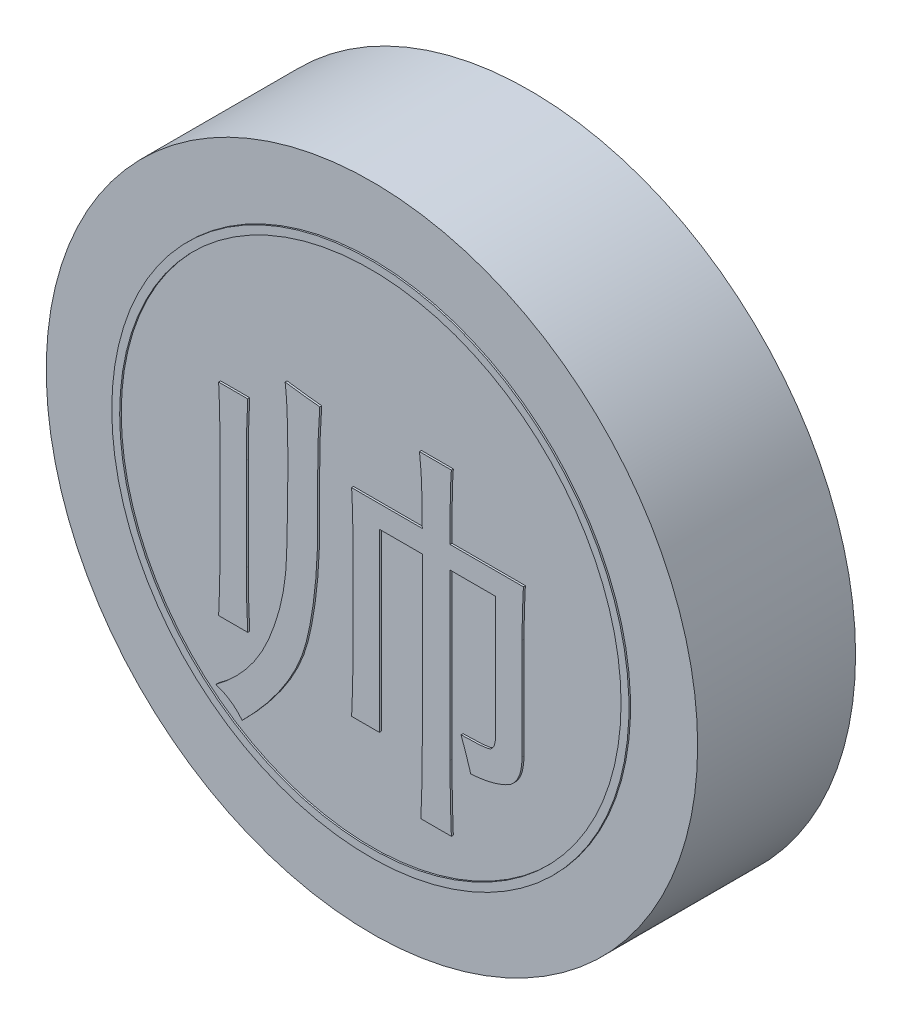
from build123d import *

# Parameters (mm, degrees)
SKETCH_1_R               = 16.5
DIAMETER33_HEIGHT8_DEPTH = 8
CHARACTER_DEPTH          = 0.1
SKETCH_3_R               = 13.1
SKETCH_3_R_2             = 12.7
INK_RING_DEPTH           = 0.08


with BuildPart() as part:
    # 草图1 → Diameter33_Height8 (new body)
    with BuildSketch(Plane.XY):
        Circle(SKETCH_1_R)
    extrude(amount=-DIAMETER33_HEIGHT8_DEPTH)

    # 草图2 → Character_帅 (add)
    with BuildSketch(Plane.XY):
        with BuildLine():
            add(Edge.make_bspline(
                [(2.649122807, 2.657894737), (2.648277509, 2.838961546), (2.646647548, 3.188106947), (2.643949337, 3.693304246), (2.627710858, 4.161013978), (2.618261471, 4.592706352), (2.59561766, 4.986803608), (2.573364544, 5.343905172), (2.545932395, 5.6629896), (2.520624442, 5.862638482), (2.50877193, 5.956140351)],
                knots=[0, 0, 0, 0, 1.315583411, 2.536797873, 3.670260287, 4.715635349, 5.673736592, 6.537953599, 7.315277556, 8, 8, 8, 8], degree=3))
            Line((2.50877193, 5.956140351), (4.122807018, 5.956140351))
            add(Edge.make_bspline(
                [(4.122807018, 5.956140351), (4.117499898, 5.877309705), (4.105781963, 5.703254378), (4.089167905, 5.417436401), (4.081123846, 5.081109437), (4.069497803, 4.693902375), (4.062208699, 4.256354693), (4.058010495, 3.768573009), (4.051072159, 3.230576781), (4.052096052, 2.854561793), (4.052631579, 2.657894737)],
                knots=[0, 0, 0, 0, 0.574688494, 1.268892212, 2.082186167, 3.021459211, 4.086593269, 5.265055303, 6.569542337, 8, 8, 8, 8], degree=3))
            Line((4.052631579, 2.657894737), (7.771929825, 2.657894737))
            add(Edge.make_bspline(
                [(7.771929825, 2.657894737), (7.760796072, 2.449999982), (7.73890673, 2.041271737), (7.719157498, 1.435549924), (7.705407242, 0.848123825), (7.702957274, 0.461670931), (7.701754386, 0.271929825)],
                knots=[0, 0, 0, 0, 1.046485867, 2.057427233, 3.046233291, 4, 4, 4, 4], degree=3))
            Line((7.701754386, 0.271929825), (7.701754386, -4.850877193))
            add(Edge.make_bspline(
                [(7.701754386, -4.850877193), (7.700509851, -4.946341409), (7.69812364, -5.129379766), (7.659319509, -5.390999722), (7.605347303, -5.628411903), (7.522536164, -5.840237206), (7.420768732, -6.029019154), (7.289859981, -6.189160821), (7.140756422, -6.328733562), (6.901013102, -6.472408104), (6.563626246, -6.612761018), (6.121927666, -6.749793211), (5.6299881, -6.842128832), (5.284963987, -6.870952514), (5.105263158, -6.885964912)],
                knots=[0, 0, 0, 0, 0.91195479, 1.748536932, 2.524193789, 3.235017793, 3.917413987, 4.565660724, 5.204897301, 5.860042995, 7.225363373, 8.690313679, 10.276197647, 12, 12, 12, 12], degree=3))
            add(Edge.make_bspline(
                [(5.105263158, -6.885964912), (5.030622329, -6.645449861), (4.877118075, -6.150813287), (4.703323003, -5.662931781), (4.614035088, -5.412280702)],
                knots=[0, 0, 0, 0, 0.972491982, 2, 2, 2, 2], degree=3))
            add(Edge.make_bspline(
                [(4.614035088, -5.412280702), (4.703272413, -5.411616614), (4.873964221, -5.410346357), (5.116579774, -5.405384501), (5.334043291, -5.397378419), (5.526579613, -5.38822529), (5.693812444, -5.372515338), (5.836088174, -5.354724862), (5.952359909, -5.334162259), (6.04894766, -5.312443399), (6.128856661, -5.275644675), (6.193160306, -5.21721386), (6.247720931, -5.142694696), (6.295806352, -5.050517957), (6.327140956, -4.938045189), (6.350107, -4.808315534), (6.366009975, -4.660655055), (6.367588242, -4.555491891), (6.368421053, -4.5)],
                knots=[0, 0, 0, 0, 1.810479571, 3.463057961, 4.922871987, 6.225442376, 7.372781237, 8.329861336, 9.133212, 9.768407665, 10.334419243, 10.894946083, 11.510128595, 12.201898471, 12.991479159, 13.867141808, 14.874545699, 16, 16, 16, 16], degree=3))
            Line((6.368421053, -4.5), (6.368421053, 1.535087719))
            Line((6.368421053, 1.535087719), (4.052631579, 1.535087719))
            Line((4.052631579, 1.535087719), (4.052631579, -6.815789474))
            add(Edge.make_bspline(
                [(4.052631579, -6.815789474), (4.053765197, -7.103428128), (4.056001813, -7.670936452), (4.069634056, -8.508736417), (4.088763125, -9.320656714), (4.11158118, -9.852421744), (4.122807018, -10.114035088)],
                knots=[0, 0, 0, 0, 1.046194404, 2.064131589, 3.047607535, 4, 4, 4, 4], degree=3))
            Line((4.122807018, -10.114035088), (2.578947368, -10.114035088))
            add(Edge.make_bspline(
                [(2.578947368, -10.114035088), (2.590173206, -9.852421744), (2.612991261, -9.320656714), (2.63212033, -8.508736417), (2.645752573, -7.670936452), (2.647989189, -7.103428128), (2.649122807, -6.815789474)],
                knots=[0, 0, 0, 0, 0.952392465, 1.935868411, 2.953805596, 4, 4, 4, 4], degree=3))
            Line((2.649122807, -6.815789474), (2.649122807, 1.535087719))
            Line((2.649122807, 1.535087719), (0.473684211, 1.535087719))
            Line((0.473684211, 1.535087719), (0.473684211, -7.377192982))
            Line((0.473684211, -7.377192982), (-0.929824561, -7.377192982))
            add(Edge.make_bspline(
                [(-0.929824561, -7.377192982), (-0.918712527, -7.137237676), (-0.89705509, -6.669562974), (-0.877305751, -5.985025613), (-0.863382791, -5.336096743), (-0.860869477, -4.914994784), (-0.859649123, -4.710526316)],
                knots=[0, 0, 0, 0, 1.08047164, 2.105847367, 3.080283338, 4, 4, 4, 4], degree=3))
            Line((-0.859649123, -4.710526316), (-0.859649123, 0.271929825))
            add(Edge.make_bspline(
                [(-0.859649123, 0.271929825), (-0.860778179, 0.479865427), (-0.863003576, 0.889711309), (-0.876691761, 1.495334741), (-0.895801581, 2.082918827), (-0.918599793, 2.468200268), (-0.929824561, 2.657894737)],
                knots=[0, 0, 0, 0, 1.045182189, 2.060078265, 3.044873733, 4, 4, 4, 4], degree=3))
            Line((-0.929824561, 2.657894737), (2.649122807, 2.657894737))
        make_face()
        with BuildLine():
            add(Edge.make_bspline(
                [(-2.543859649, 5.394736842), (-2.55453691, 5.241410089), (-2.576968973, 4.919282974), (-2.606332671, 4.4133937), (-2.625722602, 3.862230343), (-2.641455489, 3.266150249), (-2.651530629, 2.625004365), (-2.656494342, 1.938824334), (-2.656719765, 1.207587715), (-2.649857053, 0.442624259), (-2.646120363, -0.33291913), (-2.667300728, -1.096525685), (-2.709346485, -1.836581392), (-2.767619156, -2.554468791), (-2.849443973, -3.249377344), (-2.946107025, -3.921647543), (-3.067303461, -4.570685232), (-3.204881304, -5.204412609), (-3.386965023, -5.831459902), (-3.6329141, -6.458227284), (-3.948908402, -7.087582997), (-4.324035754, -7.726937374), (-4.768016313, -8.370052347), (-5.274742334, -9.020901708), (-5.843502049, -9.679758443), (-6.259926358, -10.105844174), (-6.473684211, -10.324561404)],
                knots=[0, 0, 0, 0, 0.659190093, 1.384905098, 2.173195898, 3.024385089, 3.942285353, 4.923260466, 5.96737447, 7.078396075, 8.204255659, 9.293363896, 10.354008229, 11.383098418, 12.381857005, 13.354528352, 14.295395268, 15.213084928, 16.134880166, 17.092610712, 18.096292209, 19.152239996, 20.269451564, 21.445260402, 22.688607657, 24, 24, 24, 24], degree=3))
            add(Edge.make_bspline(
                [(-6.473684211, -10.324561404), (-6.559732909, -10.223409926), (-6.732267206, -10.020593389), (-7.051816717, -9.772809488), (-7.40742211, -9.558009314), (-7.671581713, -9.461672847), (-7.807017544, -9.412280702)],
                knots=[0, 0, 0, 0, 0.970214787, 1.94535571, 2.94657452, 4, 4, 4, 4], degree=3))
            add(Edge.make_bspline(
                [(-7.807017544, -9.412280702), (-7.657973182, -9.300088741), (-7.363260789, -9.078246324), (-6.955815499, -8.710596291), (-6.57424992, -8.328429932), (-6.223348035, -7.926246582), (-5.904578485, -7.503232626), (-5.618396742, -7.059527971), (-5.360624691, -6.597131501), (-5.135263603, -6.115997615), (-4.940375439, -5.623171603), (-4.765347571, -5.126552857), (-4.614790167, -4.626941063), (-4.485965447, -4.124417421), (-4.385577394, -3.617432725), (-4.307679883, -3.107532014), (-4.251338798, -2.595099135), (-4.218416323, -1.902922648), (-4.195596224, -1.026008016), (-4.174639454, 0.042281327), (-4.161380369, 1.13219518), (-4.159064793, 1.86603464), (-4.157894737, 2.236842105)],
                knots=[0, 0, 0, 0, 0.876110196, 1.73237371, 2.575729557, 3.4124282, 4.237942316, 5.062170833, 5.891260029, 6.723431221, 7.556418375, 8.38034529, 9.196777122, 10.007322445, 10.81680406, 11.623928264, 12.430374722, 13.237591303, 14.878759917, 16.552082939, 18.25777509, 20, 20, 20, 20], degree=3))
            add(Edge.make_bspline(
                [(-4.157894737, 2.236842105), (-4.158742697, 2.42310712), (-4.160379489, 2.782648704), (-4.163043616, 3.302572137), (-4.179306434, 3.783279411), (-4.188638552, 4.224503155), (-4.21144322, 4.62552561), (-4.233545861, 4.986968321), (-4.261113513, 5.309505904), (-4.286397635, 5.510893979), (-4.298245614, 5.605263158)],
                knots=[0, 0, 0, 0, 1.325220203, 2.558031484, 3.6987413, 4.747031617, 5.69752876, 6.556083798, 7.323389997, 8, 8, 8, 8], degree=3))
            add(Edge.make_bspline(
                [(-4.298245614, 5.605263158), (-4.138880204, 5.583255195), (-3.828993721, 5.54046065), (-3.377518369, 5.48397261), (-2.952393963, 5.432706182), (-2.677341911, 5.407142736), (-2.543859649, 5.394736842)],
                knots=[0, 0, 0, 0, 1.092444961, 2.124262261, 3.089707881, 4, 4, 4, 4], degree=3))
        make_face()
        with BuildLine():
            add(Edge.make_bspline(
                [(-6.192982456, 3.921052632), (-6.213127144, 3.470616313), (-6.25390666, 2.558784097), (-6.260049539, 1.646058489), (-6.263157895, 1.184210526)],
                knots=[0, 0, 0, 0, 0.987980705, 2, 2, 2, 2], degree=3))
            Line((-6.263157895, 1.184210526), (-6.263157895, -3.51754386))
            add(Edge.make_bspline(
                [(-6.263157895, -3.51754386), (-6.262026133, -3.760132755), (-6.259790748, -4.239279455), (-6.246045202, -4.949726115), (-6.226937452, -5.6429749), (-6.204202458, -6.099339702), (-6.192982456, -6.324561404)],
                knots=[0, 0, 0, 0, 1.036632017, 2.04749195, 3.036413013, 4, 4, 4, 4], degree=3))
            Line((-6.192982456, -6.324561404), (-7.666666667, -6.324561404))
            add(Edge.make_bspline(
                [(-7.666666667, -6.324561404), (-7.655523902, -6.083740603), (-7.633604379, -5.610009217), (-7.61410139, -4.912465947), (-7.600135574, -4.241012646), (-7.597689835, -3.802584211), (-7.596491228, -3.587719298)],
                knots=[0, 0, 0, 0, 1.05657797, 2.078450635, 3.058287504, 4, 4, 4, 4], degree=3))
            Line((-7.596491228, -3.587719298), (-7.596491228, 1.254385965))
            add(Edge.make_bspline(
                [(-7.596491228, 1.254385965), (-7.597623519, 1.485712467), (-7.599858589, 1.94233606), (-7.613556549, 2.618130935), (-7.632693155, 3.27586782), (-7.655445944, 3.707961922), (-7.666666667, 3.921052632)],
                knots=[0, 0, 0, 0, 1.040483654, 2.053847617, 3.040239174, 4, 4, 4, 4], degree=3))
            Line((-7.666666667, 3.921052632), (-6.192982456, 3.921052632))
        make_face()
    extrude(amount=CHARACTER_DEPTH)

    # 草图3 → Ink_ring (add)
    with BuildSketch(Plane.XY):
        with Locations(Location((0, 0, 0), (0, 0, 180))):
            Circle(SKETCH_3_R)
        with Locations(Location((0, 0, 0), (0, 0, 180))):
            Circle(SKETCH_3_R_2, mode=Mode.SUBTRACT)
    extrude(amount=INK_RING_DEPTH)


solid = part.part
